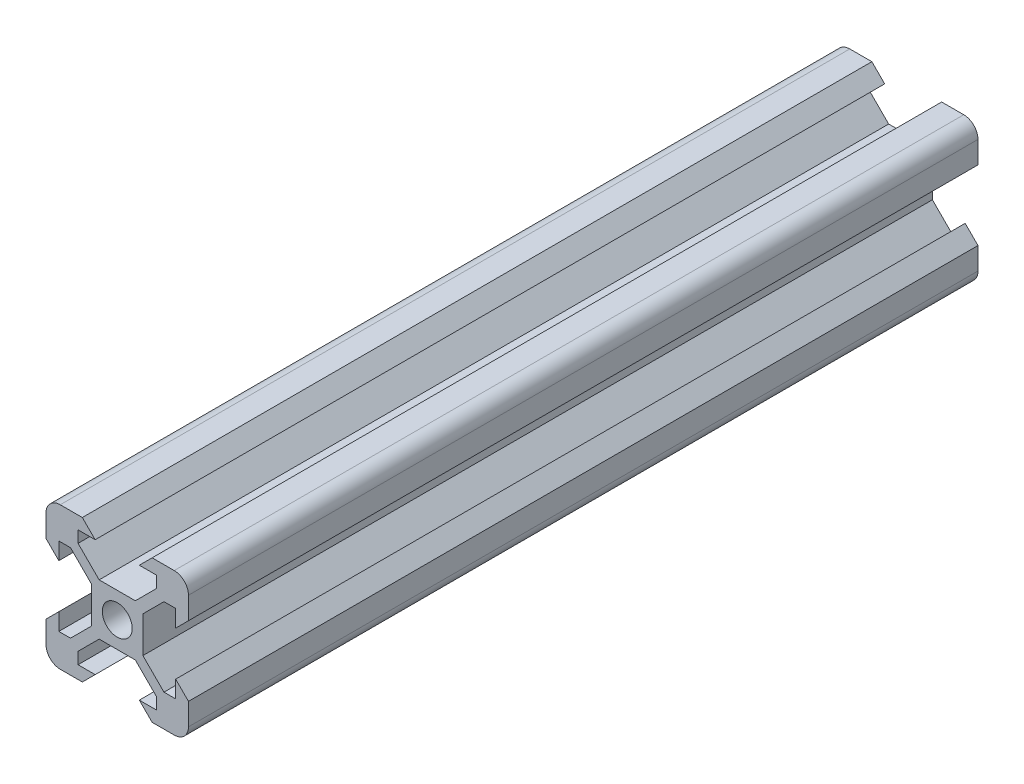
from build123d import *

# Parameters (mm, degrees)
SKETCH1_R           = 2.1
BOSS_EXTRUDE1_DEPTH = 110.83


with BuildPart() as part:
    # Sketch1 → Boss-Extrude1 (new body)
    with BuildSketch(Plane.XY):
        with BuildLine():
            Line((-4.9, -10), (-3.1, -8.2))
            Line((-3.1, -8.2), (-5.5, -8.2))
            Line((-5.5, -8.2), (-5.5, -6.560660172))
            Line((-5.5, -6.560660172), (-2.539339828, -3.6))
            Line((-2.539339828, -3.6), (2.539339828, -3.6))
            Line((2.539339828, -3.6), (5.5, -6.560660172))
            Line((5.5, -6.560660172), (5.5, -8.2))
            Line((5.5, -8.2), (3.1, -8.2))
            Line((3.1, -8.2), (4.9, -10))
            Line((4.9, -10), (8, -10))
            ThreePointArc((8, -10), (9.414213562, -9.414213562), (10, -8))
            Line((10, -8), (10, -4.9))
            Line((10, -4.9), (8.2, -3.1))
            Line((8.2, -3.1), (8.2, -5.5))
            Line((8.2, -5.5), (6.560660172, -5.5))
            Line((6.560660172, -5.5), (3.6, -2.539339828))
            Line((3.6, -2.539339828), (3.6, 2.539339828))
            Line((3.6, 2.539339828), (6.560660172, 5.5))
            Line((6.560660172, 5.5), (8.2, 5.5))
            Line((8.2, 5.5), (8.2, 3.1))
            Line((8.2, 3.1), (10, 4.9))
            Line((10, 4.9), (10, 8))
            ThreePointArc((10, 8), (9.414213562, 9.414213562), (8, 10))
            Line((8, 10), (4.9, 10))
            Line((4.9, 10), (3.1, 8.2))
            Line((3.1, 8.2), (5.5, 8.2))
            Line((5.5, 8.2), (5.5, 6.560660172))
            Line((5.5, 6.560660172), (2.539339828, 3.6))
            Line((2.539339828, 3.6), (-2.539339828, 3.6))
            Line((-2.539339828, 3.6), (-5.5, 6.560660172))
            Line((-5.5, 6.560660172), (-5.5, 8.2))
            Line((-5.5, 8.2), (-3.1, 8.2))
            Line((-3.1, 8.2), (-4.9, 10))
            Line((-4.9, 10), (-8, 10))
            ThreePointArc((-8, 10), (-9.414213562, 9.414213562), (-10, 8))
            Line((-10, 8), (-10, 4.9))
            Line((-10, 4.9), (-8.2, 3.1))
            Line((-8.2, 3.1), (-8.2, 5.5))
            Line((-8.2, 5.5), (-6.560660172, 5.5))
            Line((-6.560660172, 5.5), (-3.6, 2.539339828))
            Line((-3.6, 2.539339828), (-3.6, -2.539339828))
            Line((-3.6, -2.539339828), (-6.560660172, -5.5))
            Line((-6.560660172, -5.5), (-8.2, -5.5))
            Line((-8.2, -5.5), (-8.2, -3.1))
            Line((-8.2, -3.1), (-10, -4.9))
            Line((-10, -4.9), (-10, -8))
            ThreePointArc((-10, -8), (-9.414213562, -9.414213562), (-8, -10))
            Line((-8, -10), (-4.9, -10))
        make_face()
        Circle(SKETCH1_R, mode=Mode.SUBTRACT)
    extrude(amount=BOSS_EXTRUDE1_DEPTH)


solid = part.part
